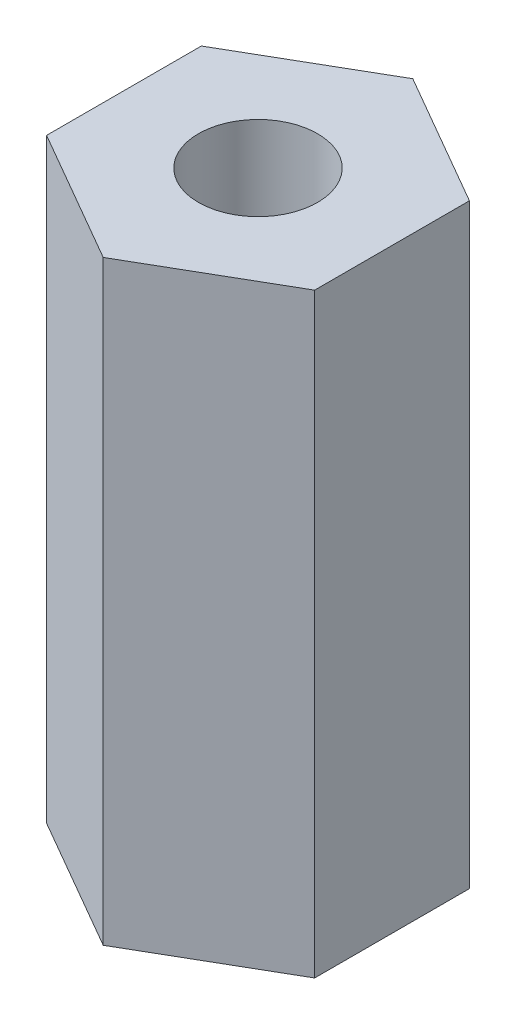
from build123d import *

# Parameters (mm, degrees)
SKETCH1_R           = 1
BOSS_EXTRUDE1_DEPTH = 10


with BuildPart() as part:
    # Sketch1 → Boss-Extrude1 (new body)
    with BuildSketch(Plane(origin=(0, 0, 0), x_dir=(1, 0, 0), z_dir=(0, 1, 0))):
        Polygon((0, 2.598076211), (-2.25, 1.299038106), (-2.25, -1.299038106), (0, -2.598076211), (2.25, -1.299038106), (2.25, 1.299038106), align=None)
        with Locations(Location((0, 0, 0), (0, 0, 270))):
            Circle(SKETCH1_R, mode=Mode.SUBTRACT)
    extrude(amount=BOSS_EXTRUDE1_DEPTH)


solid = part.part
